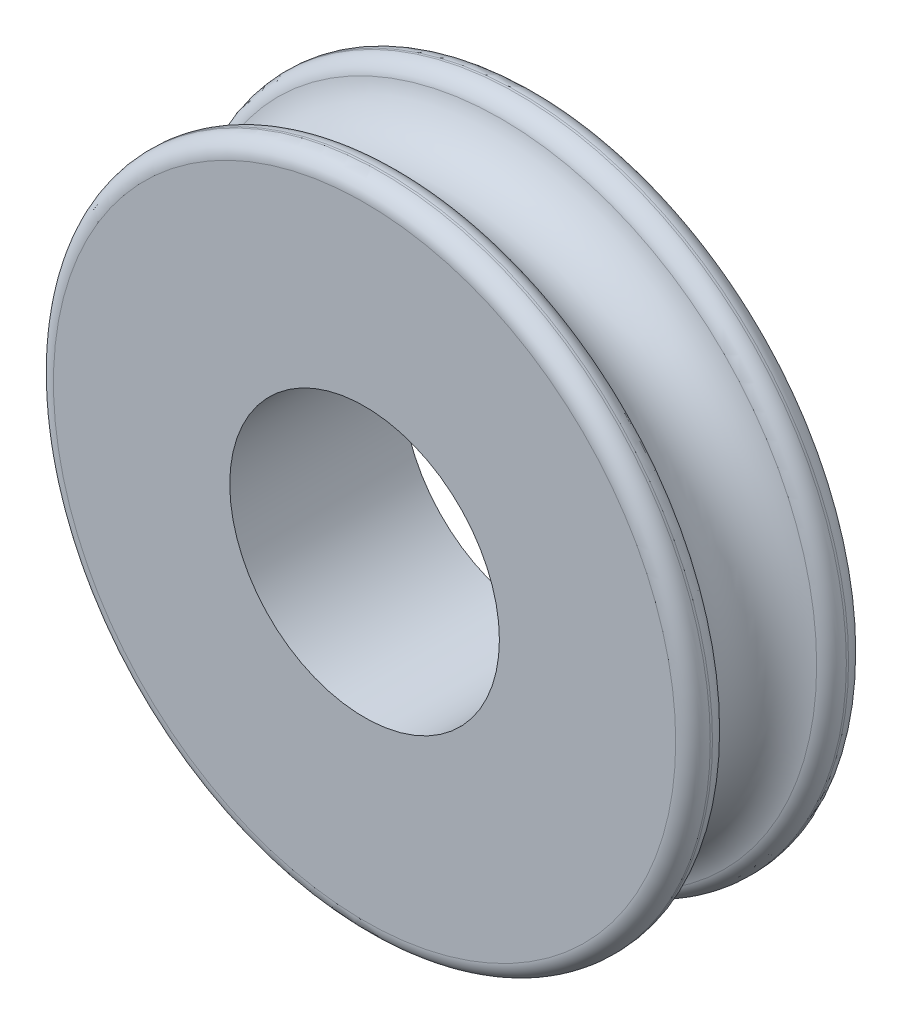
from build123d import *

# Parameters (mm, degrees)
SKETCH_1_R      = 9.5
SKETCH_1_R_2    = 3.9
EXTRUDE_1_DEPTH = 2.5
SKETCH_3_R      = 1.5
FILLET_1_R      = 0.5
FILLET_2_R      = 0.5


with BuildPart() as part:
    # Эскиз1 → Бобышка-Вытянуть1 (new, symmetric)
    with BuildSketch(Plane.XY):
        Circle(SKETCH_1_R)
        Circle(SKETCH_1_R_2, mode=Mode.SUBTRACT)
    extrude(amount=EXTRUDE_1_DEPTH, both=True)

    # Вырез-По траектории1: sweep along a path in Эскиз4
    with BuildLine(Plane.XY) as sweep_1_path:
        CenterArc((0, 0), 9.5, 0, 360)
    # Эскиз3 → Вырез-По траектории1 (sweep, cut)
    with BuildSketch(Plane(origin=(0, 0, 0), x_dir=(1, 0, 0), z_dir=(0, 1, 0))):
        with Locations((9.5, 0)):
            Circle(SKETCH_3_R)
    sweep(path=sweep_1_path.line, mode=Mode.SUBTRACT)

    # Скругление1
    fillet_1_edges = [part.edges().sort_by_distance(p)[0] for p in [
        (-9.5, 0, -2.5),
        (-9.5, 0, 2.5),
    ]]
    fillet(fillet_1_edges, radius=FILLET_1_R)

    # Скругление2
    fillet_2_edges = [part.edges().sort_by_distance(p)[0] for p in [
        (-9.5, 0, 1.5),
        (-9.5, 0, -1.5),
    ]]
    fillet(fillet_2_edges, radius=FILLET_2_R)


solid = part.part
